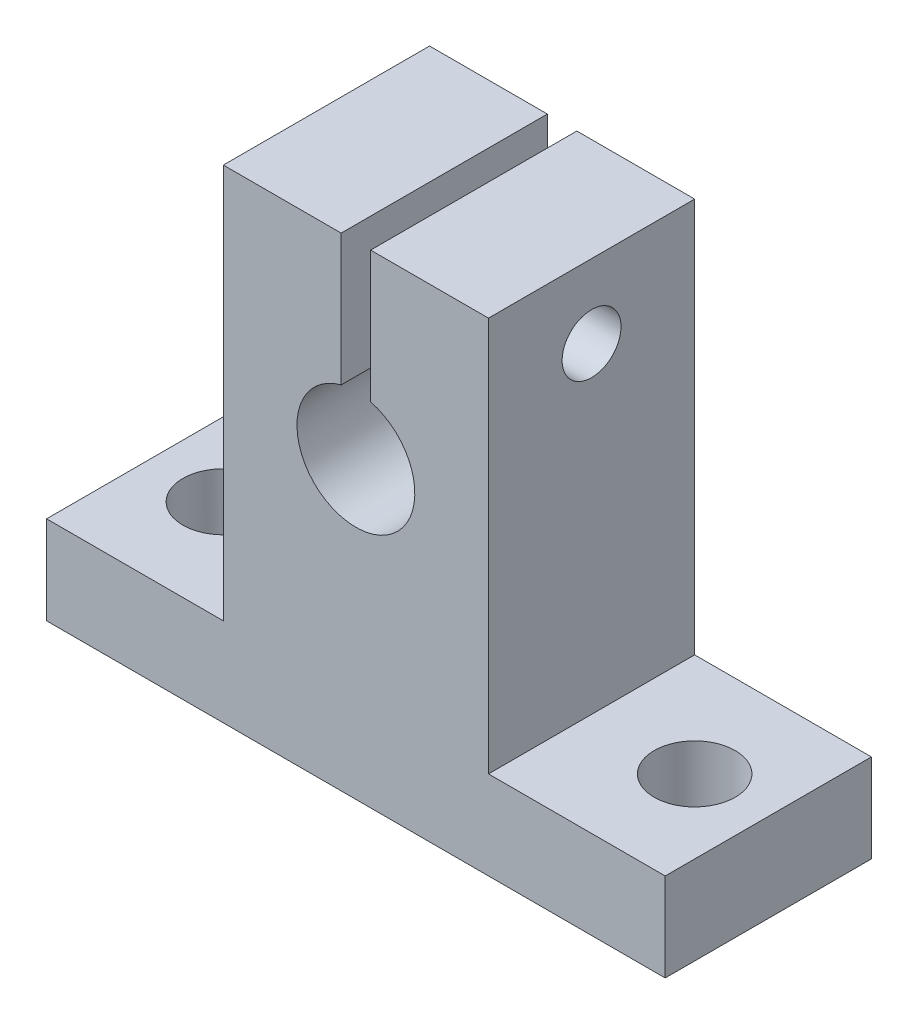
from build123d import *

# Parameters (mm, degrees)
EXTRUDE_1_DEPTH     = 14
SKETCH_2_R          = 4
SKETCH_2_W          = 2
SKETCH_2_H          = 8.927016654
CUT_EXTRUDE_2_DEPTH = 14
CUT_EXTRUDE_3_REACH = 43.386
SKETCH_4_R          = 2.75
CUT_EXTRUDE_4_REACH = 48.603
SKETCH_5_R          = 2
SKETCH_6_R          = 3.5
CUT_EXTRUDE_5_DEPTH = 4


with BuildPart() as part:
    # 草图1 → 凸台-拉伸1 (new body)
    with BuildSketch(Plane.XY):
        Polygon((21, 0), (-21, 0), (-21, 6), (-9, 6), (-9, 32.8), (9, 32.8), (9, 6), (21, 6), align=None)
    extrude(amount=EXTRUDE_1_DEPTH)

    # 草图2 → 切除-拉伸2 (cut)
    with BuildSketch(Plane(origin=(0, 0, 0), x_dir=(-1, 0, 0), z_dir=(0, 0, -1))):
        with Locations((0, 20)):
            Circle(SKETCH_2_R)
        with Locations((0, 28.336491673)):
            Rectangle(SKETCH_2_W, SKETCH_2_H)
    extrude(amount=-CUT_EXTRUDE_2_DEPTH, mode=Mode.SUBTRACT)

    # 草图4 → 切除-拉伸3 (cut, up to next)
    with BuildSketch(Plane.XZ, mode=Mode.PRIVATE) as cut_extrude_3_sk1:
        with Locations(Location((16, 7, 0), (0, 0, 270))):
            Circle(SKETCH_4_R)
    cut_extrude_3_tool1 = extrude(cut_extrude_3_sk1.sketch, amount=-CUT_EXTRUDE_3_REACH, mode=Mode.PRIVATE) & part.part
    # 草图4 → 切除-拉伸3 (cut, up to next)
    with BuildSketch(Plane.XZ, mode=Mode.PRIVATE) as cut_extrude_3_sk2:
        with Locations(Location((-16, 7, 0), (0, 0, 270))):
            Circle(SKETCH_4_R)
    cut_extrude_3_tool2 = extrude(cut_extrude_3_sk2.sketch, amount=-CUT_EXTRUDE_3_REACH, mode=Mode.PRIVATE) & part.part
    add(cut_extrude_3_tool1.solids().sort_by_distance((16, 0, 7))[0], mode=Mode.SUBTRACT)
    add(cut_extrude_3_tool2.solids().sort_by_distance((-16, 0, 7))[0], mode=Mode.SUBTRACT)

    # 切除-拉伸4: up to this face of the body (flat: up to its plane)
    cut_extrude_4_end = Plane(part.part.faces().sort_by_distance((9, 19.4, 7))[0])
    # 草图5 → 切除-拉伸4 (cut, up to the picked face)
    with BuildSketch(Plane.ZY.offset(9), mode=Mode.PRIVATE) as cut_extrude_4_sk1:
        with Locations((7, 27.8)):
            Circle(SKETCH_5_R)
    cut_extrude_4_tool1 = split(extrude(cut_extrude_4_sk1.sketch, amount=-CUT_EXTRUDE_4_REACH, mode=Mode.PRIVATE), bisect_by=cut_extrude_4_end, keep=Keep.BOTH, mode=Mode.PRIVATE)
    add(cut_extrude_4_tool1.solids().sort_by(Axis((-9, 27.8, 7), (1, 0, 0)))[0], mode=Mode.SUBTRACT)

    # 草图6 → 切除-拉伸5 (cut)
    with BuildSketch(Plane.ZY.offset(9)):
        with Locations((7, 27.8)):
            Circle(SKETCH_6_R)
    extrude(amount=-CUT_EXTRUDE_5_DEPTH, mode=Mode.SUBTRACT)


solid = part.part
